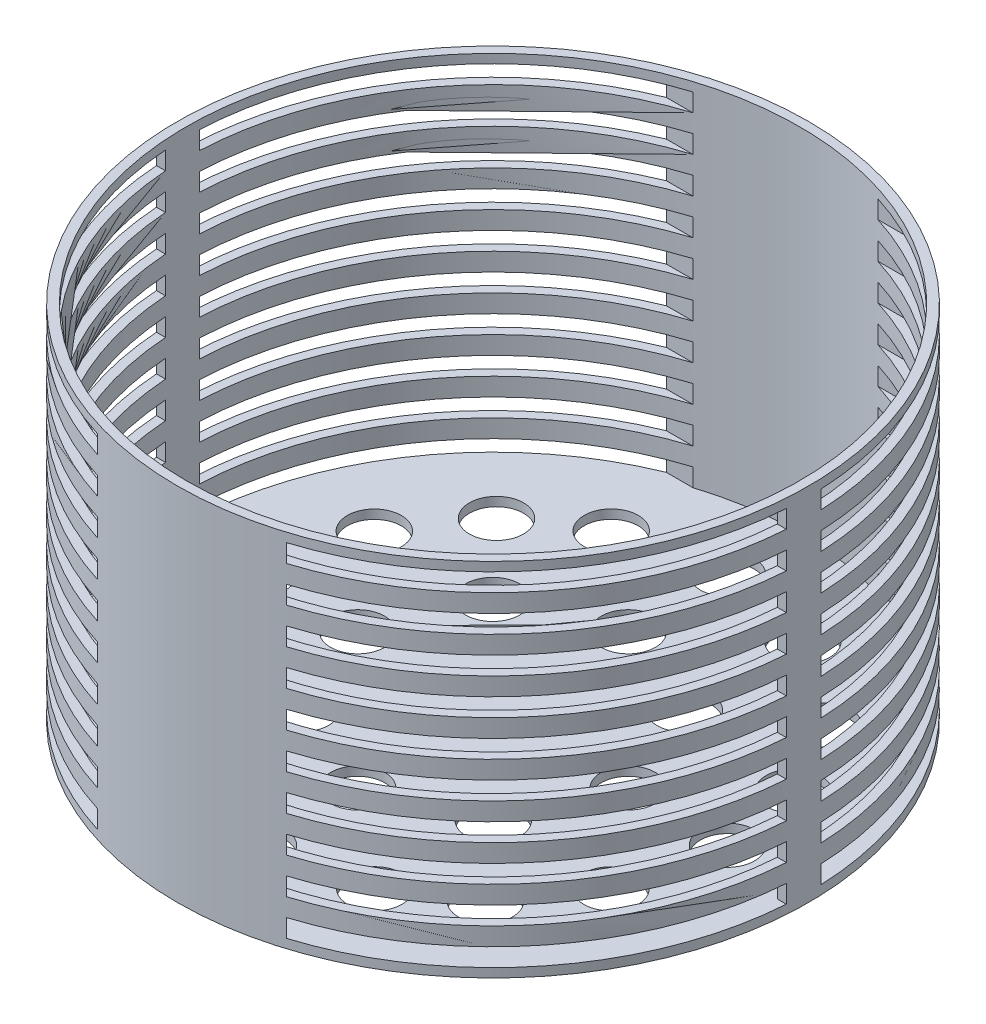
from build123d import *

# Parameters (mm, degrees)
SKETCH2_R               = 15
CUT_EXTRUDE1_DEPTH      = 10
CUT_EXTRUDE2_DEPTH      = 319.198051534
CUT_EXTRUDE2_DEPTH_BACK = 319.198051534
SKETCH3_W               = 155
SKETCH3_H               = 10


with BuildPart() as part:
    # Sketch1 → Revolve1 (revolve)
    with BuildSketch(Plane.XY, mode=Mode.PRIVATE) as revolve1_sk:
        Polygon((0, 0), (175, 0), (175, 200), (170, 200), (170, 5), (0, 5), align=None)
    revolve(revolve1_sk.sketch.rotate(Axis((0, 5, 0), (0, -1, 0)), 90), axis=Axis((0, 5, 0), (0, -1, 0)))

    # Sketch2 → Cut-Extrude1 (cut)
    with BuildSketch(Plane(origin=(0, 5, 0), x_dir=(1, 0, 0), z_dir=(0, 1, 0))):
        with Locations(Location((0, 130, 0), (0, 0, 270))):
            Circle(SKETCH2_R)
        with Locations(Location((130, 0, 0), (0, 0, 270))):
            Circle(SKETCH2_R)
        with Locations(Location((0, -130, 0), (0, 0, 270))):
            Circle(SKETCH2_R)
        with Locations(Location((-130, 0, 0), (0, 0, 270))):
            Circle(SKETCH2_R)
        with Locations(Location((-75, 0, 0), (0, 0, 270))):
            Circle(SKETCH2_R)
        with Locations(Location((0, -75, 0), (0, 0, 270))):
            Circle(SKETCH2_R)
        with Locations(Location((0, 75, 0), (0, 0, 270))):
            Circle(SKETCH2_R)
        with Locations(Location((75, 0, 0), (0, 0, 270))):
            Circle(SKETCH2_R)
        with Locations(Location((53.118504635, 52.94737449, 0), (0, 0, 270))):
            Circle(SKETCH2_R)
        with Locations(Location((-53.118504635, 52.94737449, 0), (0, 0, 270))):
            Circle(SKETCH2_R)
        with Locations(Location((-53.118504635, -52.94737449, 0), (0, 0, 270))):
            Circle(SKETCH2_R)
        with Locations(Location((53.118504635, -52.94737449, 0), (0, 0, 270))):
            Circle(SKETCH2_R)
        with Locations(Location((53.118504635, 118.6525367, 0), (0, 0, 270))):
            Circle(SKETCH2_R)
        with Locations(Location((98.935950854, 84.33076324, 0), (0, 0, 270))):
            Circle(SKETCH2_R)
        with Locations(Location((89.811978051, -93.988342886, 0), (0, 0, 270))):
            Circle(SKETCH2_R)
        with Locations(Location((53.118504635, -118.6525367, 0), (0, 0, 270))):
            Circle(SKETCH2_R)
        with Locations(Location((-53.118504635, 118.6525367, 0), (0, 0, 270))):
            Circle(SKETCH2_R)
        with Locations(Location((-118.729000394, 52.94737449, 0), (0, 0, 270))):
            Circle(SKETCH2_R)
        with Locations(Location((-120.964721023, -47.618654619, 0), (0, 0, 270))):
            Circle(SKETCH2_R)
        with Locations(Location((-97.356142709, -86.149761908, 0), (0, 0, 270))):
            Circle(SKETCH2_R)
        with Locations(Location((-90.949154302, 92.888381038, 0), (0, 0, 270))):
            Circle(SKETCH2_R)
        with Locations(Location((122.215309089, 44.310475334, 0), (0, 0, 270))):
            Circle(SKETCH2_R)
        with Locations(Location((118.605438421, -53.223584781, 0), (0, 0, 270))):
            Circle(SKETCH2_R)
        with Locations(Location((-51.639494707, -119.491070862, 0), (0, 0, 270))):
            Circle(SKETCH2_R)
    extrude(amount=-CUT_EXTRUDE1_DEPTH, mode=Mode.SUBTRACT)

    # Sketch3 → Cut-Extrude2 (cut, two sides: drawn at the far end of the back side and taken through both)
    with BuildSketch(Plane(origin=(0, 0, 0), x_dir=(0, 0, -1), z_dir=(1, 0, 0)).offset(-CUT_EXTRUDE2_DEPTH_BACK)):
        with Locations((-89.473063549, 30)):
            Rectangle(SKETCH3_W, SKETCH3_H)
        with Locations((-89.473063549, 10)):
            Rectangle(SKETCH3_W, SKETCH3_H)
        with Locations((-89.473063549, 50)):
            Rectangle(SKETCH3_W, SKETCH3_H)
        with Locations((-89.473063549, 70)):
            Rectangle(SKETCH3_W, SKETCH3_H)
        with Locations((-89.473063549, 90)):
            Rectangle(SKETCH3_W, SKETCH3_H)
        with Locations((-89.473063549, 110)):
            Rectangle(SKETCH3_W, SKETCH3_H)
        with Locations((-89.473063549, 130)):
            Rectangle(SKETCH3_W, SKETCH3_H)
        with Locations((-89.473063549, 150)):
            Rectangle(SKETCH3_W, SKETCH3_H)
        with Locations((-89.473063549, 170)):
            Rectangle(SKETCH3_W, SKETCH3_H)
        with Locations((-89.473063549, 190)):
            Rectangle(SKETCH3_W, SKETCH3_H)
        with Locations((84.580241798, 30)):
            Rectangle(SKETCH3_W, SKETCH3_H)
        with Locations((84.580241798, 10)):
            Rectangle(SKETCH3_W, SKETCH3_H)
        with Locations((84.580241798, 50)):
            Rectangle(SKETCH3_W, SKETCH3_H)
        with Locations((84.580241798, 70)):
            Rectangle(SKETCH3_W, SKETCH3_H)
        with Locations((84.580241798, 90)):
            Rectangle(SKETCH3_W, SKETCH3_H)
        with Locations((84.580241798, 110)):
            Rectangle(SKETCH3_W, SKETCH3_H)
        with Locations((84.580241798, 130)):
            Rectangle(SKETCH3_W, SKETCH3_H)
        with Locations((84.580241798, 150)):
            Rectangle(SKETCH3_W, SKETCH3_H)
        with Locations((84.580241798, 170)):
            Rectangle(SKETCH3_W, SKETCH3_H)
        with Locations((84.580241798, 190)):
            Rectangle(SKETCH3_W, SKETCH3_H)
    extrude(amount=CUT_EXTRUDE2_DEPTH + CUT_EXTRUDE2_DEPTH_BACK, mode=Mode.SUBTRACT)


solid = part.part
